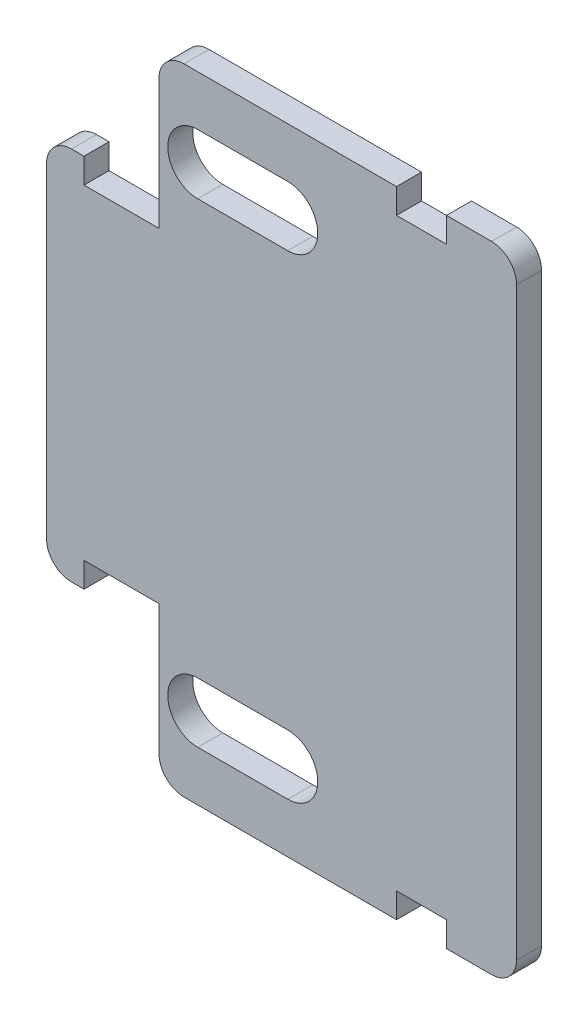
from build123d import *

# Parameters (mm, degrees)
BOSS_EXTRUDE2_DEPTH = 5
FILLET2_R           = 5


with BuildPart() as part:
    # Sketch2 → Boss-Extrude2 (new body)
    with BuildSketch(Plane.XY):
        Polygon((-52.5, -63.5), (-5, -63.5), (-5, -58.5), (5, -58.5), (5, -63.5), (19, -63.5), (19, 63.5), (5, 63.5), (5, 58.5), (-5, 58.5), (-5, 63.5), (-52.5, 63.5), (-52.5, 32.5), (-67.5, 32.5), (-67.5, 37.5), (-75, 37.5), (-75, -37.5), (-67.5, -37.5), (-67.5, -32.5), (-52.5, -32.5), align=None)
        with BuildLine():
            ThreePointArc((-44.75, -53.5), (-50.75, -47.5), (-44.75, -41.5))
            Line((-44.75, -41.5), (-26.75, -41.5))
            ThreePointArc((-26.75, -41.5), (-20.75, -47.5), (-26.75, -53.5))
            Line((-26.75, -53.5), (-44.75, -53.5))
        make_face(mode=Mode.SUBTRACT)
        with BuildLine():
            Line((-44.75, 53.5), (-26.75, 53.5))
            ThreePointArc((-26.75, 53.5), (-20.75, 47.5), (-26.75, 41.5))
            Line((-26.75, 41.5), (-44.75, 41.5))
            ThreePointArc((-44.75, 41.5), (-50.75, 47.5), (-44.75, 53.5))
        make_face(mode=Mode.SUBTRACT)
    extrude(amount=BOSS_EXTRUDE2_DEPTH)

    # Fillet2
    fillet2_edges = [part.edges().sort_by_distance(p)[0] for p in [
        (-75, -37.5, 2.5),
        (-52.5, 63.5, 2.5),
        (19, 63.5, 2.5),
        (19, -63.5, 2.5),
        (-52.5, -63.5, 2.5),
        (-75, 37.5, 2.5),
    ]]
    fillet(fillet2_edges, radius=FILLET2_R)


solid = part.part
